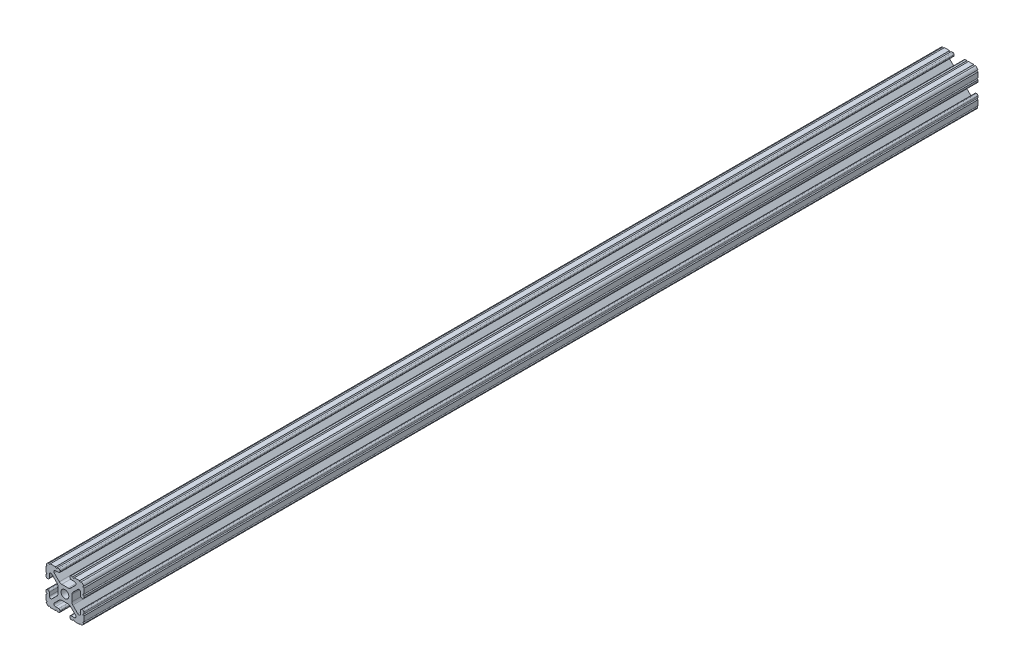
from build123d import *

# Parameters (mm, degrees)
BOSS_EXTRUDE1_DEPTH     = 300
CUT_EXTRUDE1_DEPTH      = 301.537152445
CUT_EXTRUDE1_DEPTH_BACK = 301.537152445
SKETCH5_R               = 0.55245


with BuildPart() as part:
    # Sketch4 → Boss-Extrude1 (new, symmetric)
    with BuildSketch(Plane.XY):
        with BuildLine():
            Line((4.190365, -12.7), (10.11729625, -12.7))
            ThreePointArc((10.11729625, -12.7), (11.943543585, -11.943543585), (12.7, -10.11729625))
            Line((12.7, -10.11729625), (12.7, -4.190365))
            ThreePointArc((12.7, -4.190365), (12.42492494, -3.52627506), (11.760835, -3.2512))
            Line((11.760835, -3.2512), (11.429365, -3.2512))
            ThreePointArc((11.429365, -3.2512), (10.76527506, -3.52627506), (10.4902, -4.190365))
            Line((10.4902, -4.190365), (10.4902, -6.348478019))
            ThreePointArc((10.4902, -6.348478019), (9.830707141, -7.335478831), (8.666460301, -7.103895736))
            Line((8.666460301, -7.103895736), (5.299899128, -3.737334563))
            ThreePointArc((5.299899128, -3.737334563), (4.817571085, -3.015479634), (4.6482, -2.16399369))
            Line((4.6482, -2.16399369), (4.6482, 0))
            Line((4.6482, 0), (2.6035, 0))
            ThreePointArc((2.6035, 0), (1.840952505, -1.840952505), (0, -2.6035))
            Line((0, -2.6035), (0, -4.6482))
            Line((0, -4.6482), (2.16399369, -4.6482))
            ThreePointArc((2.16399369, -4.6482), (3.015479634, -4.817571085), (3.737334563, -5.299899128))
            Line((3.737334563, -5.299899128), (7.103895736, -8.666460301))
            ThreePointArc((7.103895736, -8.666460301), (7.335478831, -9.830707141), (6.348478019, -10.4902))
            Line((6.348478019, -10.4902), (4.190365, -10.4902))
            ThreePointArc((4.190365, -10.4902), (3.52627506, -10.76527506), (3.2512, -11.429365))
            Line((3.2512, -11.429365), (3.2512, -11.760835))
            ThreePointArc((3.2512, -11.760835), (3.52627506, -12.42492494), (4.190365, -12.7))
        make_face()
    extrude(amount=BOSS_EXTRUDE1_DEPTH, both=True)

    # Sketch5 → Cut-Extrude1 (cut, two sides: drawn at the far end of the back side and taken through both)
    with BuildSketch(Plane.XY.offset(-CUT_EXTRUDE1_DEPTH_BACK)):
        with Locations((10.356153152, -12.7)):
            Circle(SKETCH5_R)
        with Locations((5.796028019, -12.7)):
            Circle(SKETCH5_R)
        with Locations((12.7, -10.356153152)):
            Circle(SKETCH5_R)
        with Locations((12.7, -5.796028019)):
            Circle(SKETCH5_R)
    extrude(amount=CUT_EXTRUDE1_DEPTH + CUT_EXTRUDE1_DEPTH_BACK, mode=Mode.SUBTRACT)

    # Mirror1: part across plane


with BuildPart() as part_1:
    add(part.part)
    add(part.part.mirror(Plane(origin=(0, 0, 0), x_dir=(0, 0, 1), z_dir=(1, 0, 0))))

    # Mirror2: part across plane


with BuildPart() as part_2:
    add(part_1.part)
    add(part_1.part.mirror(Plane.ZX))


solid = part_2.part
